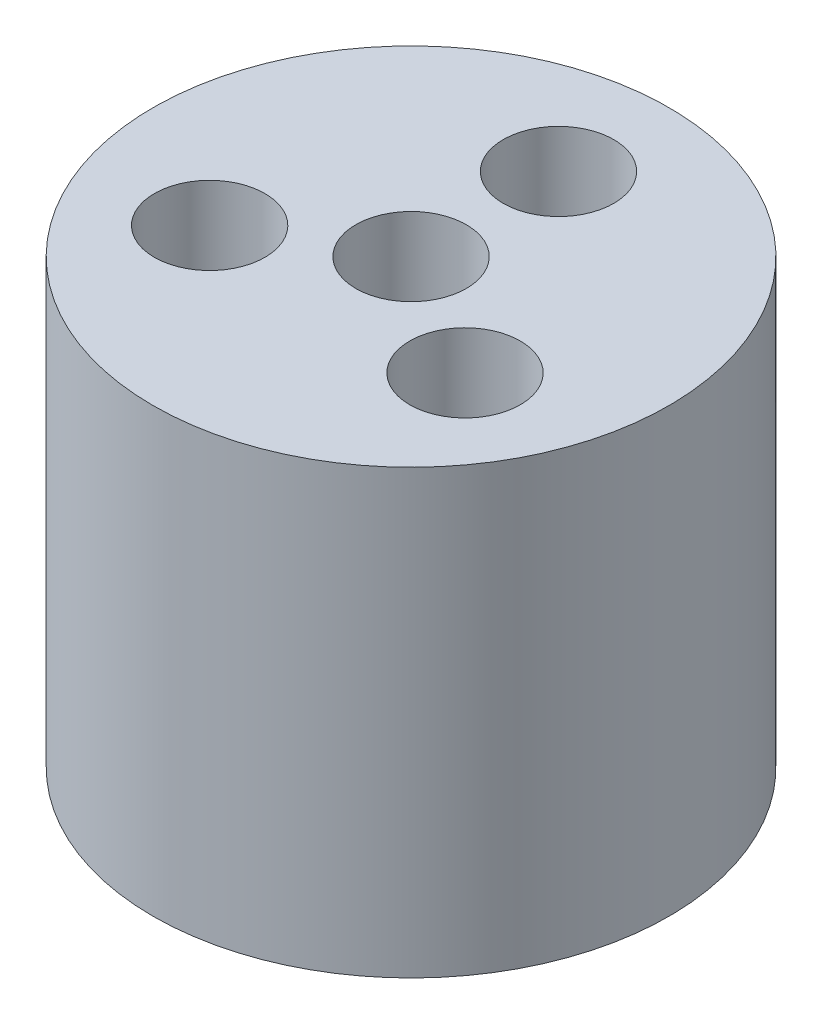
from build123d import *

# Parameters (mm, degrees)
SKETCH_1_R          = 14
EXTRUDE_1_DEPTH     = 24
SKETCH_2_R          = 3
CUT_EXTRUDE_1_DEPTH = 32.112698372


with BuildPart() as part:
    # 스케치1 → 보스-돌출1 (new body)
    with BuildSketch(Plane(origin=(0, 0, 0), x_dir=(1, 0, 0), z_dir=(0, 1, 0))):
        with Locations(Location((0, 0, 0), (0, 0, 270))):
            Circle(SKETCH_1_R)
    extrude(amount=EXTRUDE_1_DEPTH)

    # 스케치2 → 컷-돌출1 (cut, through all)
    with BuildSketch(Plane(origin=(0, 24, 0), x_dir=(1, 0, 0), z_dir=(0, 1, 0))):
        with Locations(Location((0, 8, 0), (0, 0, 270))):
            Circle(SKETCH_2_R)
        with Locations(Location((-6.92820323, -4, 0), (0, 0, 270))):
            Circle(SKETCH_2_R)
        with Locations(Location((0, 0, 0), (0, 0, 270))):
            Circle(SKETCH_2_R)
        with Locations(Location((6.92820323, -4, 0), (0, 0, 270))):
            Circle(SKETCH_2_R)
    extrude(amount=-CUT_EXTRUDE_1_DEPTH, mode=Mode.SUBTRACT)


solid = part.part
